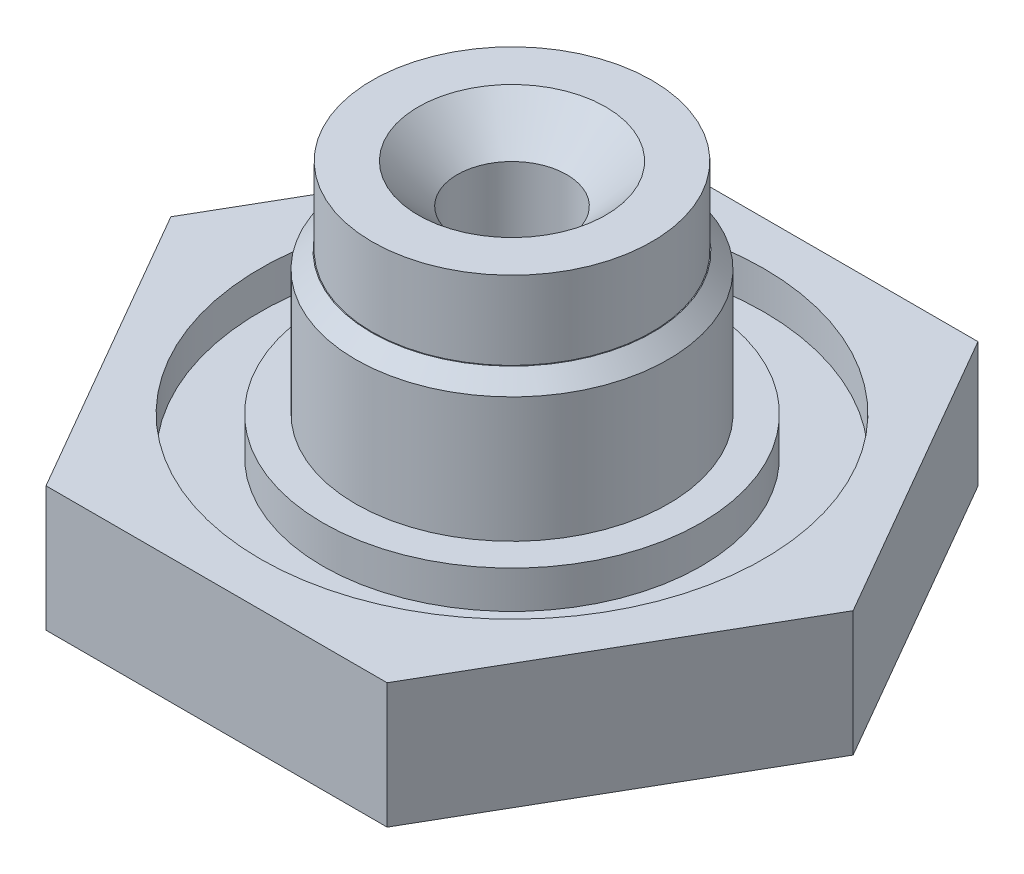
from build123d import *

# Parameters (mm, degrees)
CHANFREIN1_SIZE         = 0.5
ESQUISSE2_R             = 12.5
ENL_V_MAT_EXTRU_1_DEPTH = 20.836834425
ESQUISSE3_R             = 8.05
ESQUISSE3_R_2           = 6.05
ENL_V_MAT_EXTRU_2_DEPTH = 1.2


with BuildPart() as part:
    # Esquisse1 → Révolution1 (revolve)
    with BuildSketch(Plane.XY, mode=Mode.PRIVATE) as r_volution1_sk:
        Polygon((0.65, 0), (0.65, 1.5), (1.75, 2.6), (1.75, 14.75), (3, 16), (4.475, 16), (4.475, 13.5), (5, 13.5), (5, 9), (12.5, 9), (12.5, 5), (5.65, 5), align=None)
    revolve(r_volution1_sk.sketch.rotate(Axis((0, 0, 0), (0, 1, 0)), 90), axis=Axis((0, 0, 0), (0, 1, 0)))

    # Chanfrein1
    chanfrein1_edges = [part.edges().sort_by_distance(p)[0] for p in [
        (0, 13.5, 5),
    ]]
    chamfer(chanfrein1_edges, length=CHANFREIN1_SIZE)

    # Esquisse2 → Enlèv. mat.-Extru.1 (cut, through all)
    with BuildSketch(Plane(origin=(0, 9, 0), x_dir=(1, 0, 0), z_dir=(0, 1, 0))):
        Circle(ESQUISSE2_R)
        Polygon((-10.911920088, 0), (-5.455960044, 9.45), (5.455960044, 9.45), (10.911920088, 0), (5.455960044, -9.45), (-5.455960044, -9.45), align=None, mode=Mode.SUBTRACT)
    extrude(amount=-ENL_V_MAT_EXTRU_1_DEPTH, mode=Mode.SUBTRACT)

    # Esquisse3 → Enlèv. mat.-Extru.2 (cut)
    with BuildSketch(Plane(origin=(0, 9, 0), x_dir=(1, 0, 0), z_dir=(0, 1, 0))):
        with Locations(Location((0, 0, 0), (0, 0, 270))):
            Circle(ESQUISSE3_R)
        with Locations(Location((0, 0, 0), (0, 0, 270))):
            Circle(ESQUISSE3_R_2, mode=Mode.SUBTRACT)
    extrude(amount=-ENL_V_MAT_EXTRU_2_DEPTH, mode=Mode.SUBTRACT)


solid = part.part
